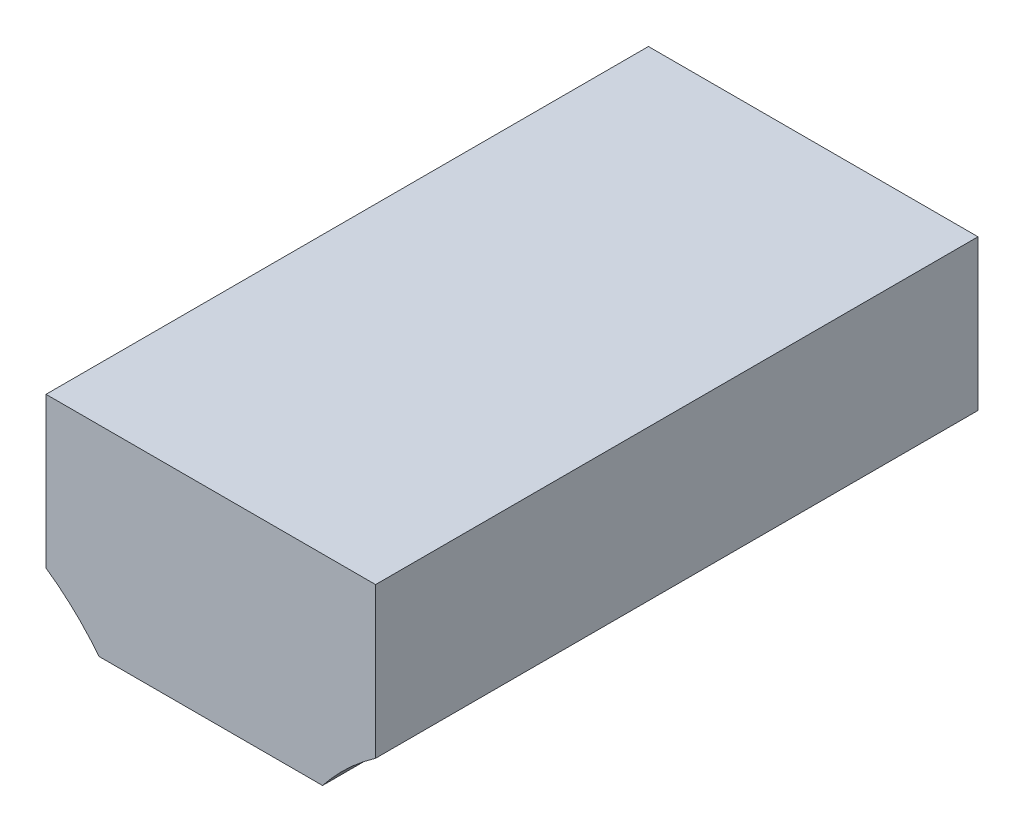
from build123d import *

# Parameters (mm, degrees)
EXTRUDE_START       = -10.064513
EXTRUDE_1_DEPTH     = 40.064513032
SKETCH_2_R          = 5.499999999
CUT_EXTRUDE_2_DEPTH = 5.5
SKETCH_3_R          = 1.999999999
CUT_EXTRUDE_3_DEPTH = 4


with BuildPart() as part:
    # Эскиз1 → Вытянуть1 (new body)
    with BuildSketch(Plane.XY.offset(EXTRUDE_START)):
        with BuildLine():
            Line((-10.958966345, 5.977749985), (10.958966345, 5.977749985))
            Line((10.958966345, 5.977749985), (10.958966345, -4.027821729))
            ThreePointArc((10.958966345, -4.027821729), (9.072657082, -5.563138372), (7.432238503, -7.358796112))
            Line((7.432238503, -7.358796112), (-7.432238503, -7.358796112))
            ThreePointArc((-7.432238503, -7.358796112), (-9.072657082, -5.563138372), (-10.958966345, -4.027821729))
            Line((-10.958966345, -4.027821729), (-10.958966345, 5.977749985))
        make_face()
    extrude(amount=EXTRUDE_1_DEPTH)

    # Эскиз2 → Вытянуть2 (cut)
    with BuildSketch(Plane.XZ.offset(7.358796112)):
        with Locations(Location((0, 9.967743485, 0), (0, 0, 270))):
            Circle(SKETCH_2_R)
    extrude(amount=-CUT_EXTRUDE_2_DEPTH, mode=Mode.SUBTRACT)

    # Эскиз3 → Вытянуть3 (cut)
    with BuildSketch(Plane.XZ.offset(1.858796112)):
        with Locations(Location((0, 9.967743485, 0), (0, 0, 270))):
            Circle(SKETCH_3_R)
    extrude(amount=-CUT_EXTRUDE_3_DEPTH, mode=Mode.SUBTRACT)


solid = part.part
